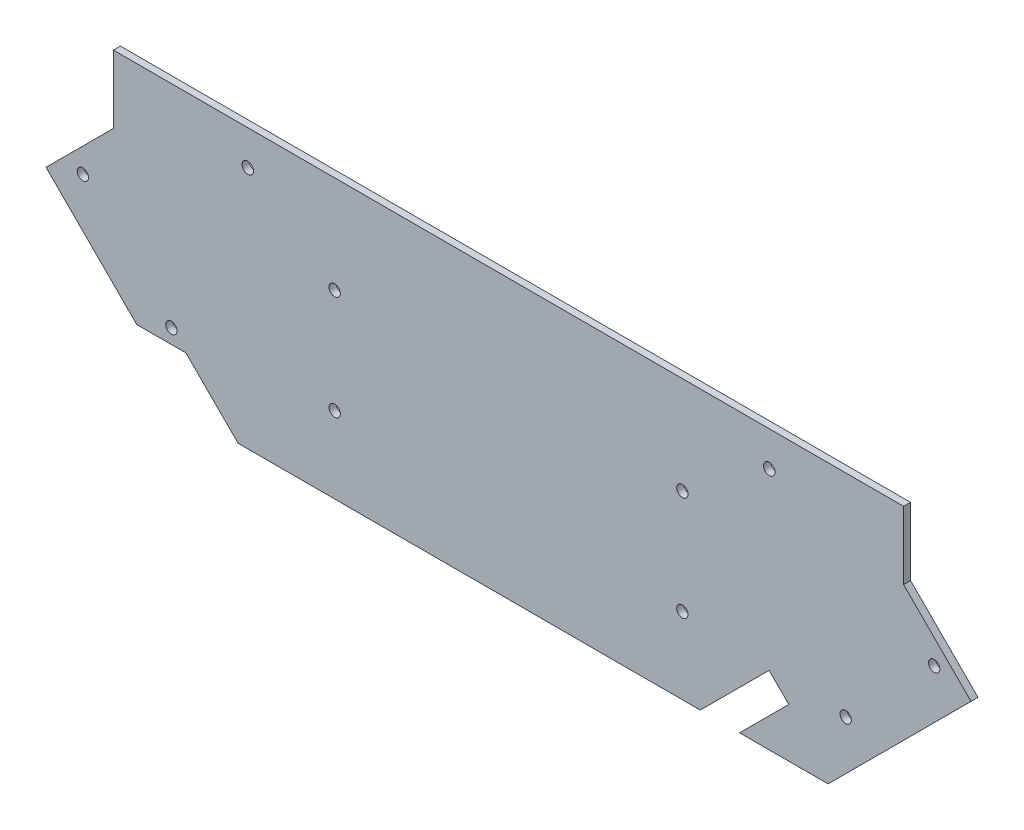
from build123d import *

# Parameters (mm, degrees)
SKETCH_1_W          = 127.26
SKETCH_1_H          = 80
EXTRUDE_1_DEPTH     = 2
EXTRUDE_2_DEPTH     = 2
SKETCH_3_R          = 1.625
SKETCH_3_R_2        = 1.65
CUT_EXTRUDE_1_DEPTH = 32


with BuildPart() as part:
    # 草图1 → 凸台-拉伸1 (new body)
    with BuildSketch(Plane.XY):
        Rectangle(SKETCH_1_W, SKETCH_1_H)
    extrude(amount=EXTRUDE_1_DEPTH)

    # 草图2 → 凸台-拉伸2 (add)
    with BuildSketch(Plane(origin=(0, 0, 0), x_dir=(-1, 0, 0), z_dir=(0, 0, -1))):
        Polygon((143.63, 40), (63.63, 40), (63.63, -40), (91.914271247, -40), (157.772135624, 25.857864376), align=None)
        Polygon((-63.63, -40), (-63.63, 40), (-143.63, 40), (-157.772135624, 25.857864376), (-91.914271247, -40), align=None)
    extrude(amount=-EXTRUDE_2_DEPTH)

    # 草图3 → 切除-拉伸1 (cut)
    with BuildSketch(Plane.XY.offset(2)):
        with Locations((-50, 12)):
            Circle(SKETCH_3_R)
        with Locations((-50, -18)):
            Circle(SKETCH_3_R)
        with Locations((50, 12)):
            Circle(SKETCH_3_R)
        with Locations((50, -18)):
            Circle(SKETCH_3_R)
        with Locations((-122.416796564, 4.644660941)):
            Circle(SKETCH_3_R)
        with Locations((-96.960952442, -20.811183182)):
            Circle(SKETCH_3_R)
        with Locations((96.960952442, -20.811183182)):
            Circle(SKETCH_3_R)
        with Locations((122.416796564, 4.644660941)):
            Circle(SKETCH_3_R)
        with Locations((-75, 30)):
            Circle(SKETCH_3_R_2)
        with Locations((75, 30)):
            Circle(SKETCH_3_R_2)
        Polygon((80.600562748, -25.857864376), (74.943708499, -20.201010127), (55.144718626, -40), (66.458427125, -40), align=None)
        Polygon((-106.914271247, -25), (-92.772135624, -25), (-77.772135624, -40), (-106.914271247, -40), align=None)
        Polygon((-133.023398282, 1.109127035), (-113.63, 20.502525317), (-113.63, 40), (-143.63, 40), (-157.772135624, 25.857864376), align=None)
        Polygon((157.772135624, 25.857864376), (133.023398282, 1.109127035), (113.63, 20.502525317), (113.63, 40), (143.63, 40), align=None)
    extrude(amount=-CUT_EXTRUDE_1_DEPTH, mode=Mode.SUBTRACT)


solid = part.part
